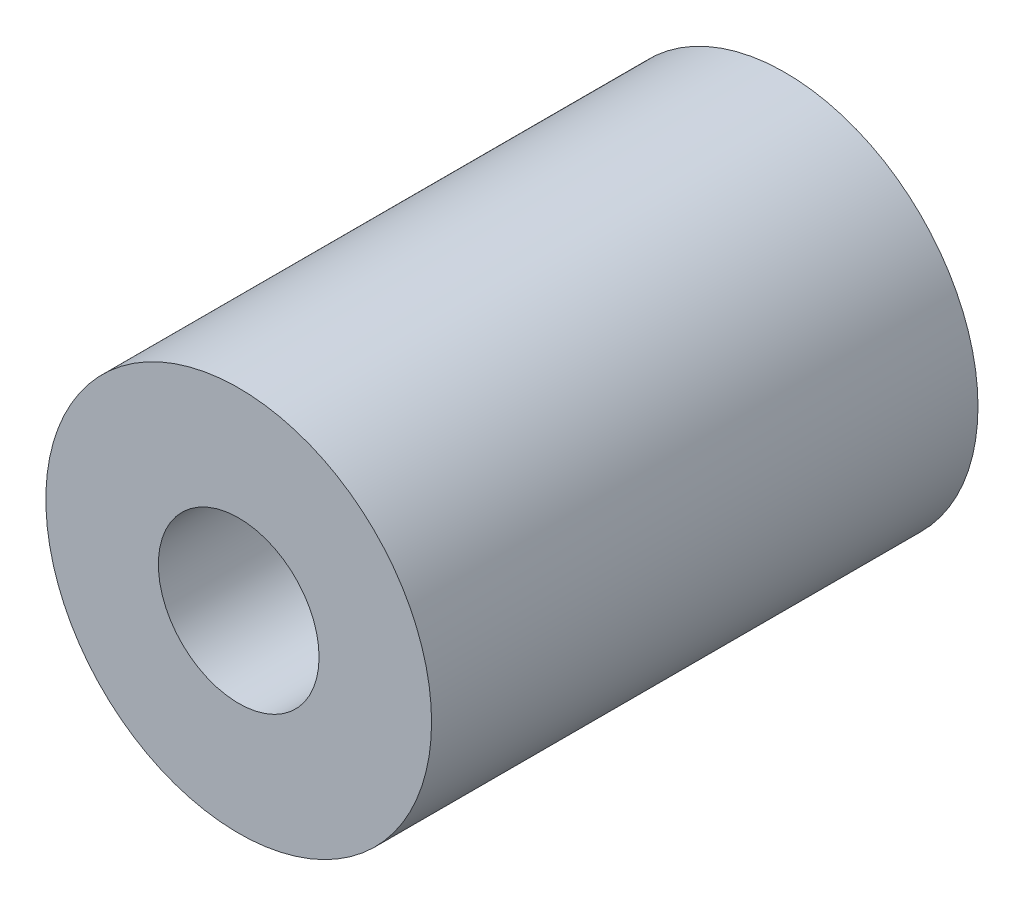
from build123d import *

# Parameters (mm, degrees)
SKETCH_1_R      = 3
SKETCH_1_R_2    = 1.25
EXTRUDE_1_DEPTH = 8.5


with BuildPart() as part:
    # ｽｹｯﾁ1 → ﾎﾞｽ - 押し出し1 (new body)
    with BuildSketch(Plane.XY):
        Circle(SKETCH_1_R)
        Circle(SKETCH_1_R_2, mode=Mode.SUBTRACT)
    extrude(amount=EXTRUDE_1_DEPTH)


solid = part.part
